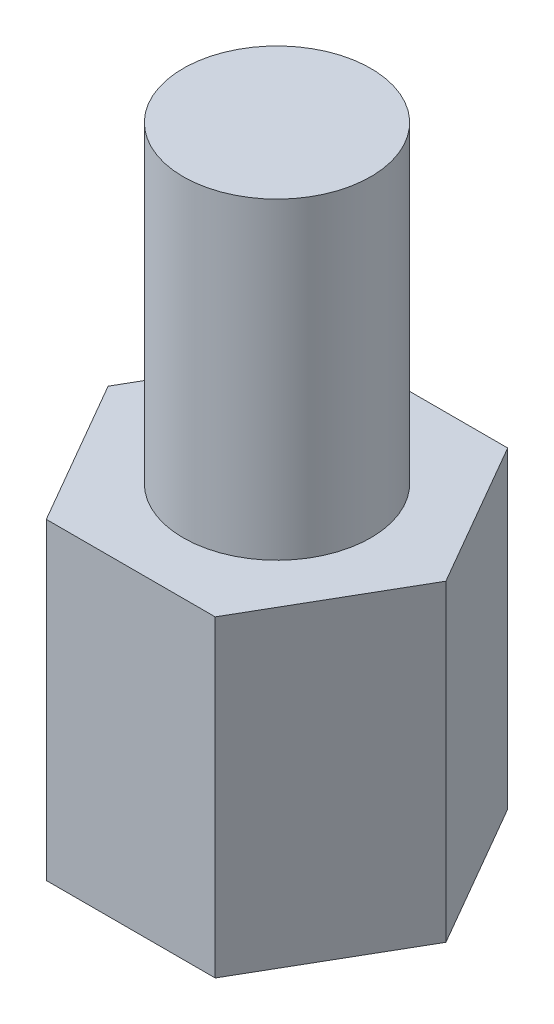
from build123d import *

# Parameters (mm, degrees)
EXTRUDE_1_DEPTH          = 5
SKETCH_2_R               = 1.5
EXTRUDE_2_DEPTH          = 10
CUT_EXTRUDE_2_DEPTH      = 5
CUT_EXTRUDE_2_DEPTH_BACK = 1
SKETCH_3_R               = 1.5


with BuildPart() as part:
    # 草图1 → 凸台-拉伸1 (new body)
    with BuildSketch(Plane(origin=(0, 0, 0), x_dir=(1, 0, 0), z_dir=(0, 1, 0))):
        Polygon((2.7, 0), (1.35, 2.33826859), (-1.35, 2.33826859), (-2.7, 0), (-1.35, -2.33826859), (1.35, -2.33826859), align=None)
    extrude(amount=EXTRUDE_1_DEPTH)

    # 草图2 → 凸台-拉伸2 (add)
    with BuildSketch(Plane(origin=(0, 0, 0), x_dir=(1, 0, 0), z_dir=(0, 1, 0))):
        with Locations(Location((0, 0, 0), (0, 0, 270))):
            Circle(SKETCH_2_R)
    extrude(amount=EXTRUDE_2_DEPTH)

    # 草图3 → 切除-拉伸2 (cut, two sides: drawn at the far end of the back side and taken through both)
    with BuildSketch(Plane(origin=(0, 0, 0), x_dir=(1, 0, 0), z_dir=(0, 1, 0)).offset(-CUT_EXTRUDE_2_DEPTH_BACK)):
        with Locations(Location((0, 0, 0), (0, 0, 270))):
            Circle(SKETCH_3_R)
    extrude(amount=CUT_EXTRUDE_2_DEPTH + CUT_EXTRUDE_2_DEPTH_BACK, mode=Mode.SUBTRACT)


with BuildPart() as cut_extrude_2_piece_1:
    # of the separate pieces the step leaves, piece 1, a body of its own (cut_extrude_2_pieces)
    add(part.part.solids().sort_by_distance((2.7, 0, 0))[0])


with BuildPart() as cut_extrude_2_piece_2:
    # of the separate pieces the step leaves, piece 2, a body of its own (cut_extrude_2_pieces)
    add(part.part.solids().sort_by_distance((0, 10, 1.5))[0])


solid = Compound([cut_extrude_2_piece_1.part, cut_extrude_2_piece_2.part])
